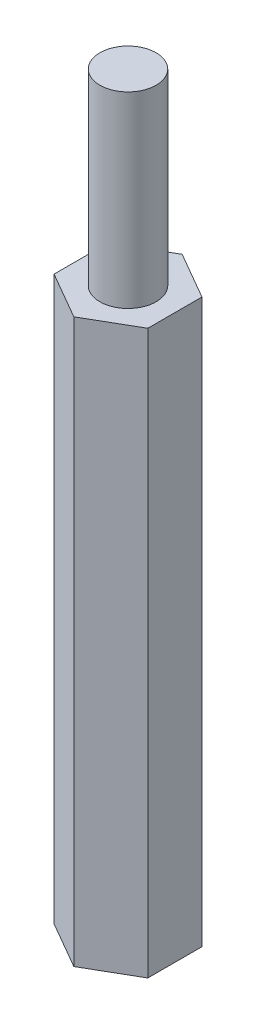
from build123d import *

# Parameters (mm, degrees)
BOSS_EXTRUDE1_DEPTH = 30
SKETCH2_R           = 1.5
BOSS_EXTRUDE2_DEPTH = 10
SKETCH3_R           = 1.5
CUT_EXTRUDE1_DEPTH  = 10


with BuildPart() as part:
    # Sketch1 → Boss-Extrude1 (new body)
    with BuildSketch(Plane(origin=(0, 0, 0), x_dir=(1, 0, 0), z_dir=(0, 1, 0))):
        Polygon((2.5, -1.443375673), (2.5, 1.443375673), (0, 2.886751346), (-2.5, 1.443375673), (-2.5, -1.443375673), (0, -2.886751346), align=None)
    extrude(amount=BOSS_EXTRUDE1_DEPTH)

    # Sketch2 → Boss-Extrude2 (add)
    with BuildSketch(Plane(origin=(0, 30, 0), x_dir=(1, 0, 0), z_dir=(0, 1, 0))):
        with Locations(Location((0, 0, 0), (0, 0, 270))):
            Circle(SKETCH2_R)
    extrude(amount=BOSS_EXTRUDE2_DEPTH)

    # Sketch3 → Cut-Extrude1 (cut)
    with BuildSketch(Plane.XZ):
        with Locations(Location((0, 0, 0), (0, 0, 90))):
            Circle(SKETCH3_R)
    extrude(amount=-CUT_EXTRUDE1_DEPTH, mode=Mode.SUBTRACT)


solid = part.part
